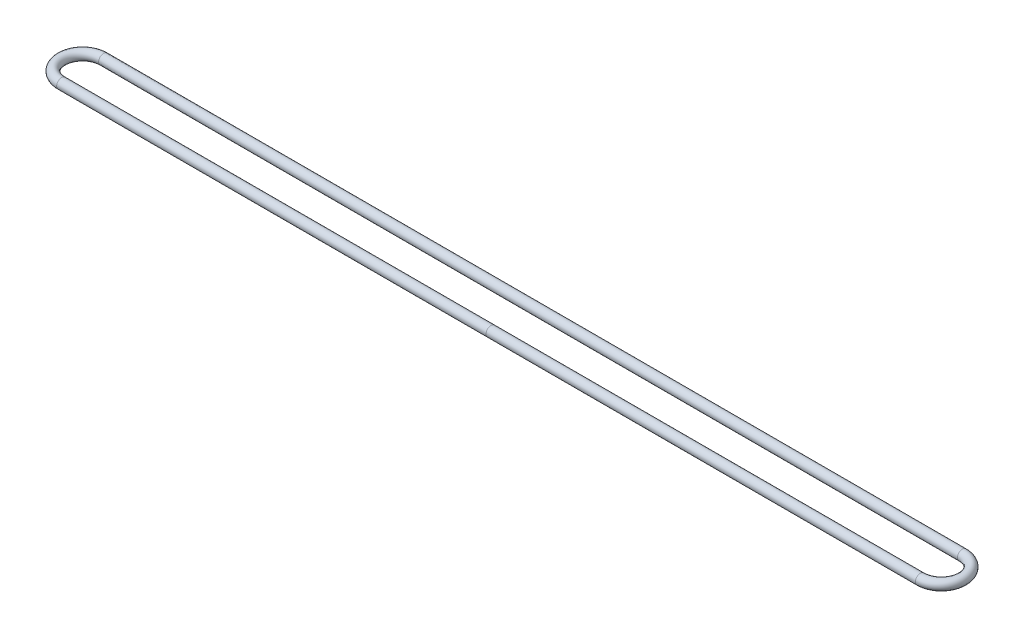
from build123d import *

# Parameters (mm, degrees)
SKETCH2_R = 1.651


with BuildPart() as part:
    # Sweep1: sweep along a path in Sketch1
    with BuildLine(Plane(origin=(0, 0, 0), x_dir=(1, 0, 0), z_dir=(0, 1, 0))) as sweep1_path:
        Line((-142.875, 6.985), (142.875, 6.985))
        ThreePointArc((142.875, 6.985), (149.86, 0), (142.875, -6.985))
        Line((142.875, -6.985), (-142.875, -6.985))
        ThreePointArc((-142.875, -6.985), (-149.86, 0), (-142.875, 6.985))
    # Sketch2 → Sweep1 (sweep)
    with BuildSketch(Plane(origin=(0, 0, 0), x_dir=(0, 0, -1), z_dir=(1, 0, 0))):
        with Locations((-6.985, 0)):
            Circle(SKETCH2_R)
    sweep(path=sweep1_path.line)


solid = part.part
